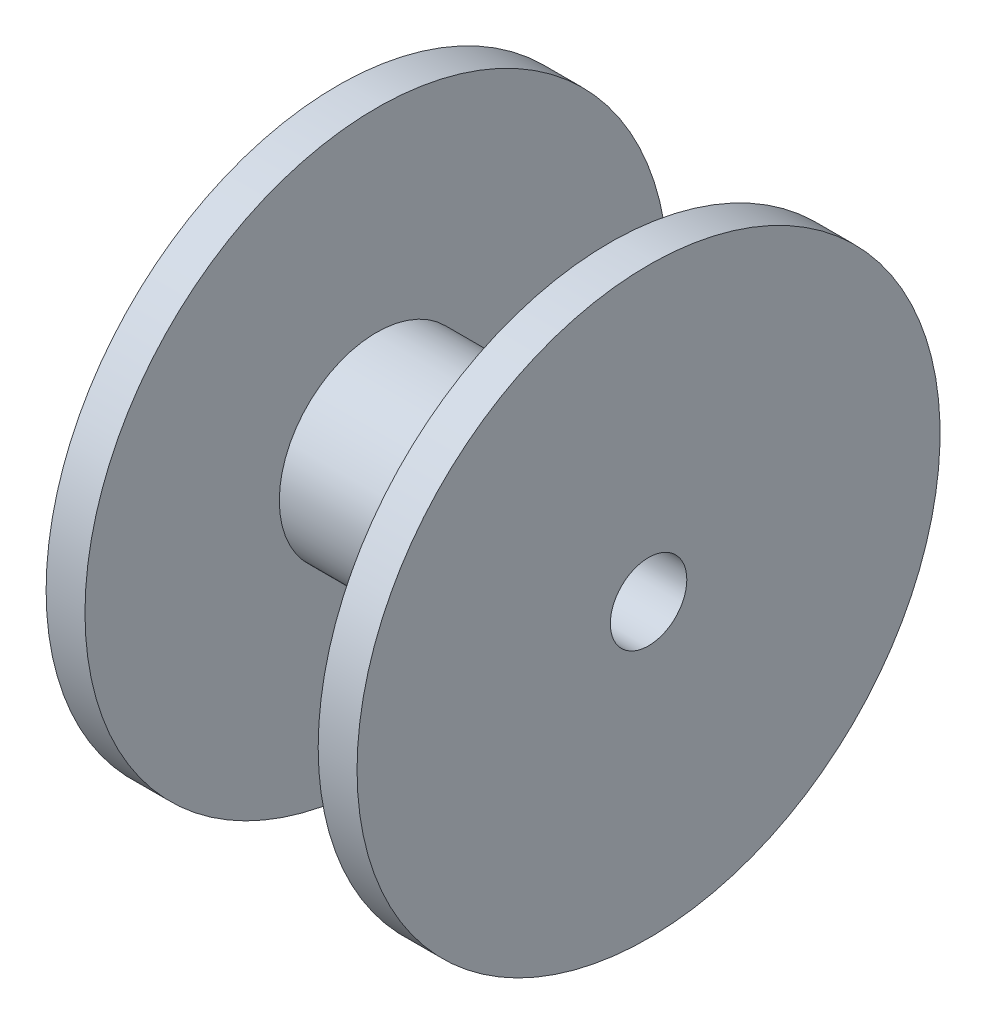
from build123d import *

# Parameters (mm, degrees)
SKETCH2_R          = 5
CUT_EXTRUDE1_DEPTH = 40.64


with BuildPart() as part:
    # Sketch1 → Revolve1 (revolve)
    with BuildSketch(Plane.XY, mode=Mode.PRIVATE) as revolve1_sk:
        Polygon((0, 0), (40.64, 0), (40.64, -38.1), (35.56, -38.1), (35.56, -12.7), (5.08, -12.7), (5.08, -38.1), (0, -38.1), align=None)
    revolve(revolve1_sk.sketch.rotate(Axis((0, 0, 0), (1, 0, 0)), 270), axis=Axis((0, 0, 0), (1, 0, 0)))

    # Sketch2 → Cut-Extrude1 (cut)
    with BuildSketch(Plane(origin=(40.64, 0, 0), x_dir=(0, 0, -1), z_dir=(1, 0, 0))):
        Circle(SKETCH2_R)
    extrude(amount=-CUT_EXTRUDE1_DEPTH, mode=Mode.SUBTRACT)


solid = part.part
